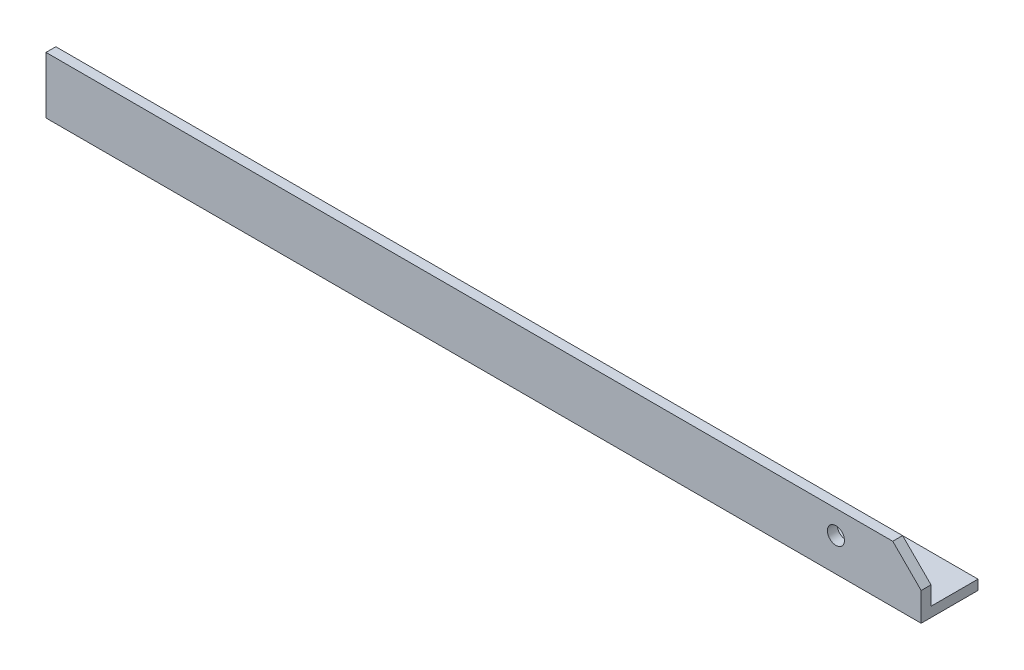
from build123d import *

# Parameters (mm, degrees)
BOSS_EXTRUDE1_DEPTH = 308
SKETCH2_R           = 3
CUT_EXTRUDE1_DEPTH  = 310.295974756


with BuildPart() as part:
    # Sketch1 → Boss-Extrude1 (new body)
    with BuildSketch(Plane(origin=(0, 0, 0), x_dir=(0, 0, -1), z_dir=(1, 0, 0))):
        Polygon((0, 0), (20, 0), (20, 3.461178467), (3.461178467, 3.461178467), (3.461178467, 20), (0, 20), align=None)
    extrude(amount=BOSS_EXTRUDE1_DEPTH)

    # Sketch2 → Cut-Extrude1 (cut, through all)
    with BuildSketch(Plane.XY):
        with Locations((278, 11.75)):
            Circle(SKETCH2_R)
        Polygon((308, 10), (298, 20), (308, 20), align=None)
    extrude(amount=-CUT_EXTRUDE1_DEPTH, mode=Mode.SUBTRACT)


solid = part.part
